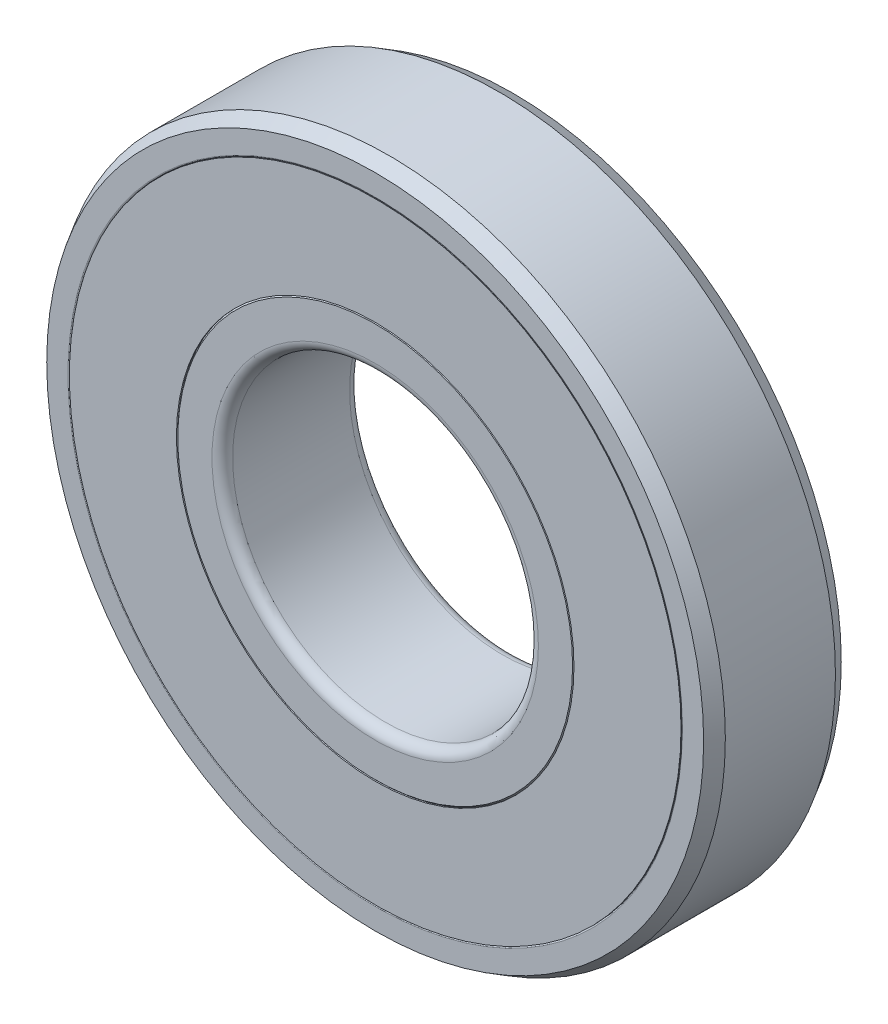
from build123d import *

# Parameters (mm, degrees)
SKETCH4_W         = 0.3571875
SKETCH4_H         = 5.55625
CIRPATTERN1_COUNT = 7


with BuildPart() as part:
    # Sketch3 → Revolve1 (revolve)
    with BuildSketch(Plane(origin=(0, 0, 0), x_dir=(0, 0, -1), z_dir=(1, 0, 0)), mode=Mode.PRIVATE) as revolve1_sk:
        with BuildLine():
            Line((-2.8575, -17.4625), (2.8575, -17.4625))
            Line((2.8575, -17.4625), (3.571875, -17.050055401))
            Line((3.571875, -17.050055401), (3.571875, -15.9464375))
            ThreePointArc((3.571875, -15.9464375), (3.550951441, -15.895923559), (3.5004375, -15.875))
            Line((3.5004375, -15.875), (1.617478657, -15.875))
            ThreePointArc((1.617478657, -15.875), (0, -16.3115625), (-1.617478657, -15.875))
            Line((-1.617478657, -15.875), (-3.5004375, -15.875))
            ThreePointArc((-3.5004375, -15.875), (-3.550951441, -15.895923559), (-3.571875, -15.9464375))
            Line((-3.571875, -15.9464375), (-3.571875, -17.050055401))
            Line((-3.571875, -17.050055401), (-2.8575, -17.4625))
        make_face()
        with BuildLine():
            Line((-3.03609375, -7.9375), (3.03609375, -7.9375))
            ThreePointArc((3.03609375, -7.9375), (3.414948305, -8.094426695), (3.571875, -8.47328125))
            Line((3.571875, -8.47328125), (3.571875, -10.2473125))
            Line((3.571875, -10.2473125), (3.5004375, -10.31875))
            Line((3.5004375, -10.31875), (1.617478657, -10.31875))
            ThreePointArc((1.617478657, -10.31875), (0, -9.8821875), (-1.617478657, -10.31875))
            Line((-1.617478657, -10.31875), (-3.5004375, -10.31875))
            Line((-3.5004375, -10.31875), (-3.571875, -10.2473125))
            Line((-3.571875, -10.2473125), (-3.571875, -8.47328125))
            ThreePointArc((-3.571875, -8.47328125), (-3.414948305, -8.094426695), (-3.03609375, -7.9375))
        make_face()
    revolve(revolve1_sk.sketch.rotate(Axis((0, 0, 3.571875), (0, 0, -1)), 270), axis=Axis((0, 0, 3.571875), (0, 0, -1)))


with BuildPart() as body_2:
    # Sketch4 → Revolve2 (revolve)
    with BuildSketch(Plane(origin=(0, 0, 0), x_dir=(0, 0, -1), z_dir=(1, 0, 0)), mode=Mode.PRIVATE) as revolve2_sk:
        with Locations((-3.39328125, -13.096875)):
            Rectangle(SKETCH4_W, SKETCH4_H)
    revolve(revolve2_sk.sketch.rotate(Axis((0, 0, 3.571875), (0, 0, -1)), 270), axis=Axis((0, 0, 3.571875), (0, 0, -1)))


with BuildPart() as body_3:
    # Sketch5 → Revolve3 (revolve)
    with BuildSketch(Plane(origin=(0, 0, 0), x_dir=(0, 0, -1), z_dir=(1, 0, 0))):
        with BuildLine():
            Line((0, -9.8821875), (0, -16.3115625))
            ThreePointArc((0, -16.3115625), (-3.2146875, -13.096875), (0, -9.8821875))
        make_face()
    revolve(axis=Axis((0, 0, 0), (0, -1, 0)))


with BuildPart() as cirpattern1_1:
    # CirPattern1: pattern copy
    add(body_3.part.rotate(Axis((0, 0, 0), (0, 0, 1)), 1 * 360 / CIRPATTERN1_COUNT))


with BuildPart() as cirpattern1_2:
    # CirPattern1: pattern copy
    add(body_3.part.rotate(Axis((0, 0, 0), (0, 0, 1)), 2 * 360 / CIRPATTERN1_COUNT))


with BuildPart() as cirpattern1_3:
    # CirPattern1: pattern copy
    add(body_3.part.rotate(Axis((0, 0, 0), (0, 0, 1)), 3 * 360 / CIRPATTERN1_COUNT))


with BuildPart() as cirpattern1_4:
    # CirPattern1: pattern copy
    add(body_3.part.rotate(Axis((0, 0, 0), (0, 0, 1)), 4 * 360 / CIRPATTERN1_COUNT))


with BuildPart() as cirpattern1_5:
    # CirPattern1: pattern copy
    add(body_3.part.rotate(Axis((0, 0, 0), (0, 0, 1)), 5 * 360 / CIRPATTERN1_COUNT))


with BuildPart() as cirpattern1_6:
    # CirPattern1: pattern copy
    add(body_3.part.rotate(Axis((0, 0, 0), (0, 0, 1)), 6 * 360 / CIRPATTERN1_COUNT))


solid = Compound([part.part, body_2.part, body_3.part, cirpattern1_1.part, cirpattern1_2.part, cirpattern1_3.part, cirpattern1_4.part, cirpattern1_5.part, cirpattern1_6.part])
